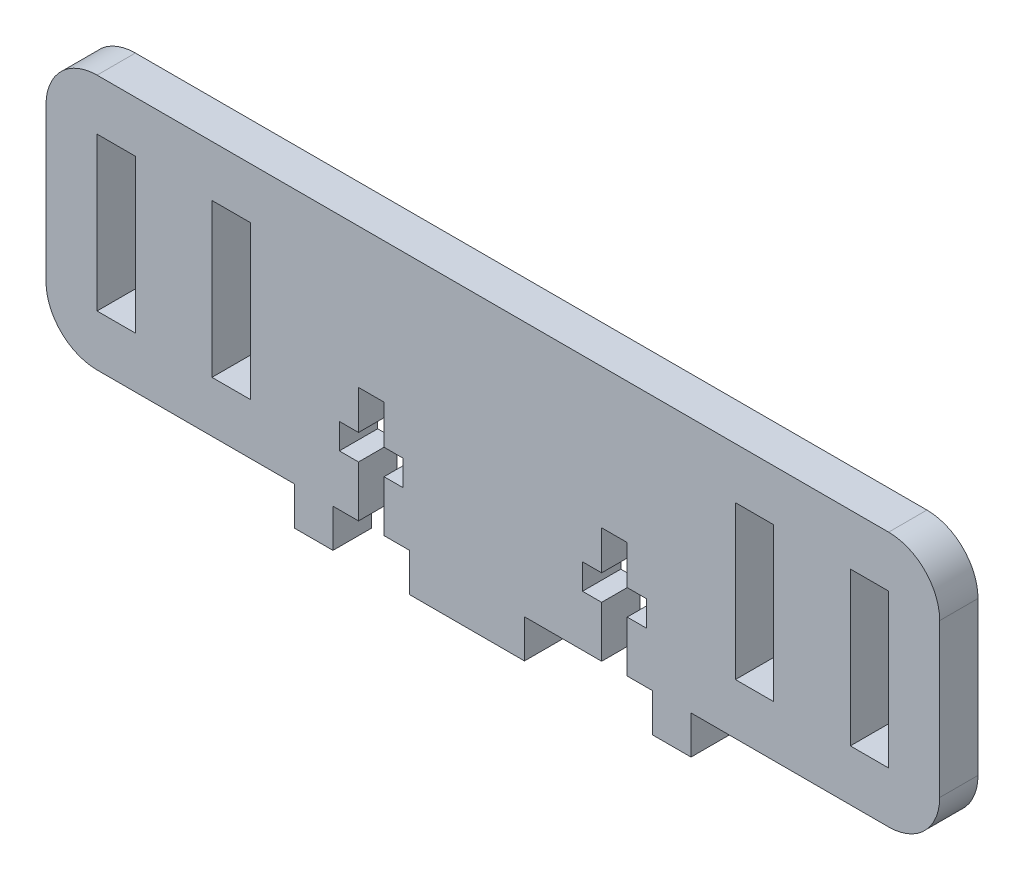
from build123d import *

# Parameters (mm, degrees)
ESQUISSE1_W             = 15
ESQUISSE1_H             = 60
BOSS_EXTRU_1_DEPTH      = 15
ESQUISSE2_W             = 10
ESQUISSE2_H             = 8.70960714
ESQUISSE2_H_2           = 11.830290252
ENL_V_MAT_EXTRU_1_DEPTH = 183.619823677
ESQUISSE3_W             = 15
ESQUISSE3_H             = 15
ESQUISSE3_W_2           = 45
BOSS_EXTRU_2_DEPTH      = 15


with BuildPart() as part:
    # Esquisse1 → Boss.-Extru.1 (new body)
    with BuildSketch(Plane.XY):
        with BuildLine():
            ThreePointArc((-175, -30), (-169.142135624, -44.142135624), (-155, -50))
            Line((-155, -50), (155, -50))
            ThreePointArc((155, -50), (169.142135624, -44.142135624), (175, -30))
            Line((175, -30), (175, 30))
            ThreePointArc((175, 30), (169.142135624, 44.142135624), (155, 50))
            Line((155, 50), (-155, 50))
            ThreePointArc((-155, 50), (-169.142135624, 44.142135624), (-175, 30))
            Line((-175, 30), (-175, -30))
        make_face()
        with Locations((-147.5, 0)):
            Rectangle(ESQUISSE1_W, ESQUISSE1_H, mode=Mode.SUBTRACT)
        Polygon((-52.61, -30), (-60.11, -30), (-60.11, -20), (-52.61, -20), (-52.61, -4.714066344), (-42.61, -4.714066344), (-42.61, -20), (-35.11, -20), (-35.11, -30), (-42.61, -30), (-42.61, -45.27278392), (-52.61, -45.27278392), align=None, mode=Mode.SUBTRACT)
        Polygon((42.61, -30), (35.11, -30), (35.11, -20), (42.61, -20), (42.61, -4.714066344), (52.61, -4.714066344), (52.61, -20), (60.11, -20), (60.11, -30), (52.61, -30), (52.61, -45.27278392), (42.61, -45.27278392), align=None, mode=Mode.SUBTRACT)
        with Locations((-102.5, 0)):
            Rectangle(ESQUISSE1_W, ESQUISSE1_H, mode=Mode.SUBTRACT)
        with Locations((102.5, 0)):
            Rectangle(ESQUISSE1_W, ESQUISSE1_H, mode=Mode.SUBTRACT)
        with Locations((147.5, 0)):
            Rectangle(ESQUISSE1_W, ESQUISSE1_H, mode=Mode.SUBTRACT)
    extrude(amount=BOSS_EXTRU_1_DEPTH)

    # Esquisse2 → Enlèv. mat.-Extru.1 (cut, through all)
    with BuildSketch(Plane.XY.offset(15)):
        with Locations((47.61, -49.62758749)):
            Rectangle(ESQUISSE2_W, ESQUISSE2_H)
        with Locations((-47.61, -51.187929046)):
            Rectangle(ESQUISSE2_W, ESQUISSE2_H_2)
    extrude(amount=-ENL_V_MAT_EXTRU_1_DEPTH, mode=Mode.SUBTRACT)

    # Esquisse3 → Boss.-Extru.2 (add)
    with BuildSketch(Plane(origin=(0, -50, 0), x_dir=(-1, 0, 0), z_dir=(0, -1, 0))):
        with Locations((-70.11, -7.5)):
            Rectangle(ESQUISSE3_W, ESQUISSE3_H)
        with Locations((10.11, -7.5)):
            Rectangle(ESQUISSE3_W_2, ESQUISSE3_H)
        with Locations((70.11, -7.5)):
            Rectangle(ESQUISSE3_W, ESQUISSE3_H)
    extrude(amount=BOSS_EXTRU_2_DEPTH)


solid = part.part
